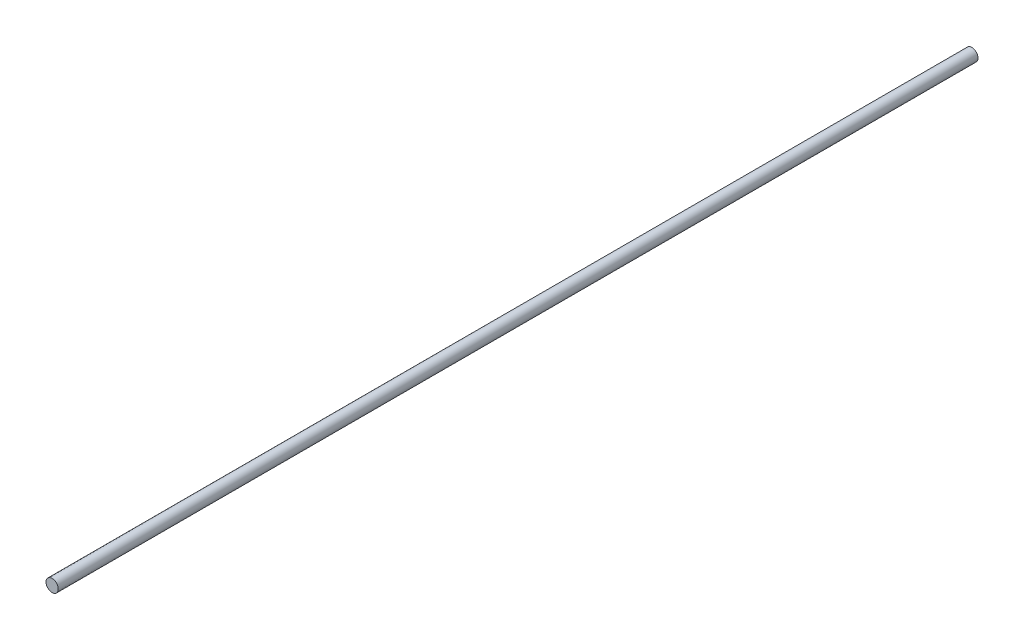
from build123d import *

# Parameters (mm, degrees)
ESBO_O1_R                = 2
RESSALTO_EXTRUS_O1_DEPTH = 300


with BuildPart() as part:
    # Esboço1 → Ressalto-extrusão1 (new body)
    with BuildSketch(Plane.XY):
        Circle(ESBO_O1_R)
    extrude(amount=RESSALTO_EXTRUS_O1_DEPTH)


solid = part.part
